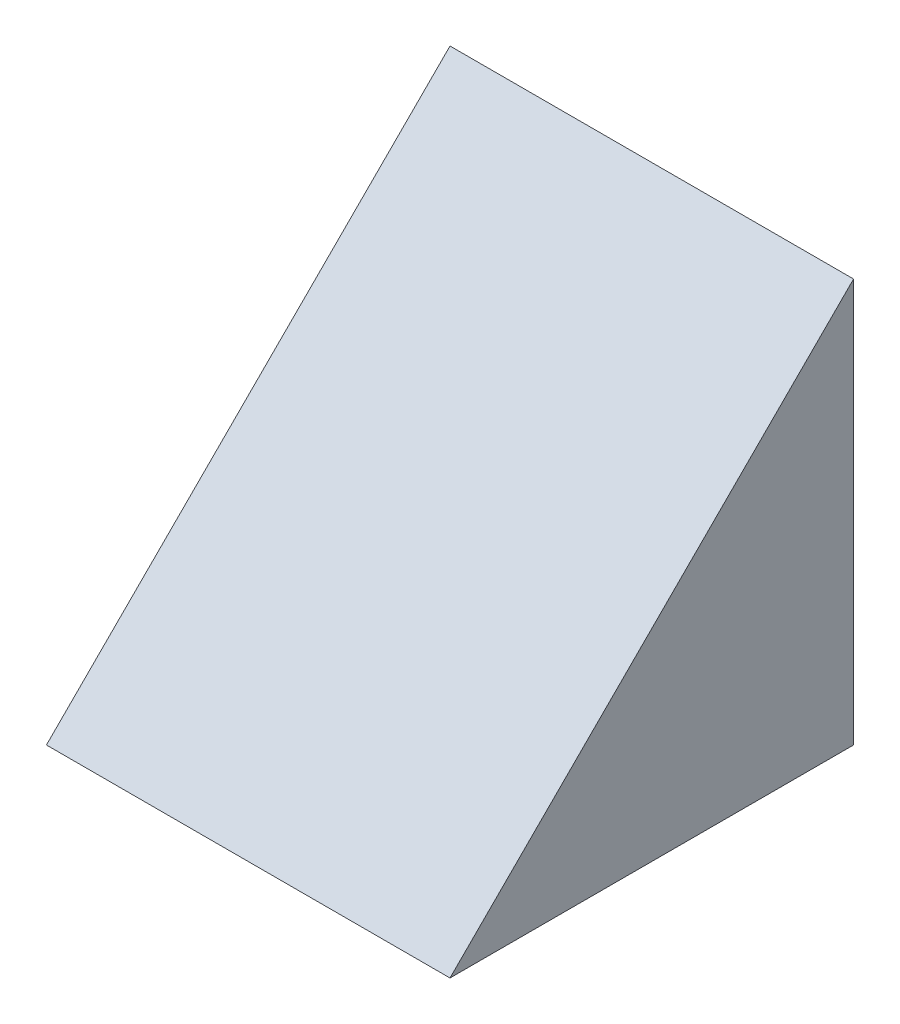
from build123d import *

# Parameters (mm, degrees)
BOSS_EXTRUDE1_DEPTH = 1


with BuildPart() as part:
    # Sketch1 → Boss-Extrude1 (new body)
    with BuildSketch(Plane(origin=(0, 0, 0), x_dir=(0, 0, -1), z_dir=(1, 0, 0))):
        Polygon((-0.5, -0.5), (0.5, 0.5), (0.5, -0.5), align=None)
    extrude(amount=BOSS_EXTRUDE1_DEPTH)


solid = part.part
